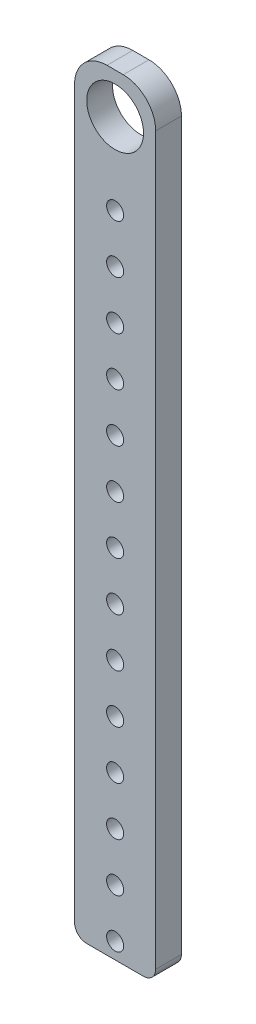
from build123d import *

# Parameters (mm, degrees)
SKETCH1_W           = 20
SKETCH1_H           = 190
SKETCH1_R           = 2.1
SKETCH1_R_2         = 7
BOSS_EXTRUDE1_DEPTH = 6.35
FILLET1_R           = 3
FILLET2_R           = 8


with BuildPart() as part:
    # Sketch1 → Boss-Extrude1 (new body)
    with BuildSketch(Plane.XY):
        Rectangle(SKETCH1_W, SKETCH1_H)
        with Locations((0, -91)):
            Circle(SKETCH1_R, mode=Mode.SUBTRACT)
        with Locations((0, -79)):
            Circle(SKETCH1_R, mode=Mode.SUBTRACT)
        with Locations((0, -67)):
            Circle(SKETCH1_R, mode=Mode.SUBTRACT)
        with Locations((0, -55)):
            Circle(SKETCH1_R, mode=Mode.SUBTRACT)
        with Locations((0, -43)):
            Circle(SKETCH1_R, mode=Mode.SUBTRACT)
        with Locations((0, -31)):
            Circle(SKETCH1_R, mode=Mode.SUBTRACT)
        with Locations((0, -19)):
            Circle(SKETCH1_R, mode=Mode.SUBTRACT)
        with Locations((0, 85)):
            Circle(SKETCH1_R_2, mode=Mode.SUBTRACT)
        with Locations((0, -7)):
            Circle(SKETCH1_R, mode=Mode.SUBTRACT)
        with Locations((0, 5)):
            Circle(SKETCH1_R, mode=Mode.SUBTRACT)
        with Locations((0, 17)):
            Circle(SKETCH1_R, mode=Mode.SUBTRACT)
        with Locations((0, 29)):
            Circle(SKETCH1_R, mode=Mode.SUBTRACT)
        with Locations((0, 41)):
            Circle(SKETCH1_R, mode=Mode.SUBTRACT)
        with Locations((0, 53)):
            Circle(SKETCH1_R, mode=Mode.SUBTRACT)
        with Locations((0, 65)):
            Circle(SKETCH1_R, mode=Mode.SUBTRACT)
    extrude(amount=BOSS_EXTRUDE1_DEPTH)

    # Fillet1
    fillet1_edges = [part.edges().sort_by_distance(p)[0] for p in [
        (10, -95, 3.175),
        (-10, -95, 3.175),
    ]]
    fillet(fillet1_edges, radius=FILLET1_R)

    # Fillet2
    fillet2_edges = [part.edges().sort_by_distance(p)[0] for p in [
        (-10, 95, 3.175),
        (10, 95, 3.175),
    ]]
    fillet(fillet2_edges, radius=FILLET2_R)


solid = part.part
